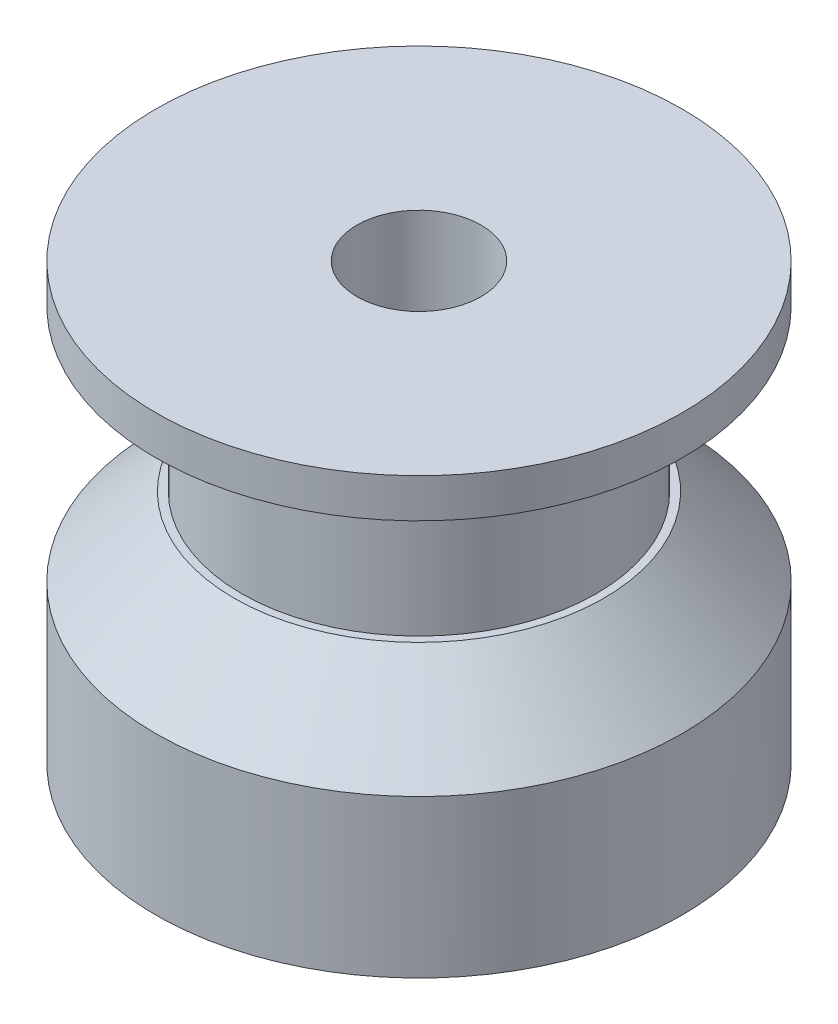
from build123d import *

# Parameters (mm, degrees)
CHAMFER1_SIZE             = 2
M2X0_4_TAPPED_HOLE1_D     = 1.6
M2X0_4_TAPPED_HOLE1_DEPTH = 3
M2X0_4_TAPPED_HOLE1_TIP   = 0.480688495


with BuildPart() as part:
    # Sketch1 → Revolve1 (revolve)
    with BuildSketch(Plane.XY, mode=Mode.PRIVATE) as revolve1_sk:
        Polygon((1.5875, 0), (1.5875, 11.1252), (6.73, 11.1252), (6.73, 10.1252), (4.5339, 10.1252), (4.5339, 6.019800098), (6.731, 6.019800098), (6.731, 0), align=None)
    revolve(revolve1_sk.sketch.rotate(Axis((0, 0, 0), (0, 1, 0)), 90), axis=Axis((0, 0, 0), (0, 1, 0)))

    # Chamfer1
    chamfer1_edges = [part.edges().sort_by_distance(p)[0] for p in [
        (0, 6.019800098, 6.731),
    ]]
    chamfer(chamfer1_edges, length=CHAMFER1_SIZE)

    # M2x0.4 Tapped Hole1
    with Locations(Plane(origin=(0, 0, 0), x_dir=(-1, 0, 0), z_dir=(0, -1, 0))):
        with Locations((0, -4.977300526), (-4.977300526, 0), (0, 4.977300526), (4.977300526, 0), (0, 0)):
            Hole(M2X0_4_TAPPED_HOLE1_D / 2, depth=M2X0_4_TAPPED_HOLE1_DEPTH)
            with Locations((0, 0, -(M2X0_4_TAPPED_HOLE1_DEPTH + M2X0_4_TAPPED_HOLE1_TIP / 2))):  # 118° drill point
                Cone(0, M2X0_4_TAPPED_HOLE1_D / 2, M2X0_4_TAPPED_HOLE1_TIP, mode=Mode.SUBTRACT)


solid = part.part
